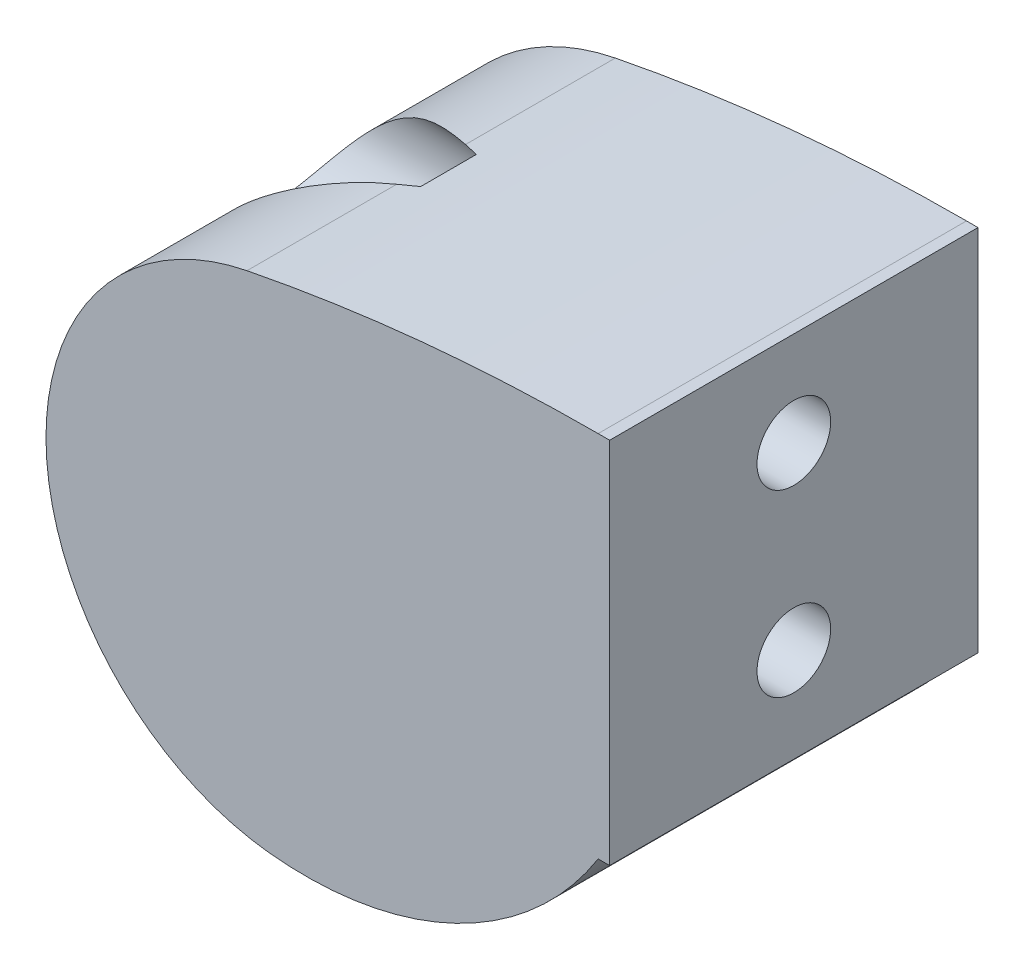
from build123d import *

# Parameters (mm, degrees)
BOSS_EXTRUDE1_DEPTH = 16
CUT_EXTRUDE1_DEPTH  = 27.570660511
SKETCH3_R           = 1.6
CUT_EXTRUDE2_DEPTH  = 33.870624557
SKETCH4_R           = 3
CUT_EXTRUDE3_DEPTH  = 27.570660628


with BuildPart() as part:
    # Sketch1 → Boss-Extrude1 (new body)
    with BuildSketch(Plane.XY):
        with BuildLine():
            Line((12.68857754, 8), (13.18857754, 8))
            Line((13.18857754, 8), (13.18857754, -8))
            Line((13.18857754, -8), (12.68857754, -8))
            ThreePointArc((12.68857754, -8), (-15, 0), (12.68857754, 8))
        make_face()
    extrude(amount=BOSS_EXTRUDE1_DEPTH)

    # Sketch2 → Cut-Extrude1 (cut, through all)
    with BuildSketch(Plane.XY.offset(16)):
        with BuildLine():
            Line((-1.638653084, -14.910225219), (-1.638653084, -32.417274257))
            Line((-1.638653084, -32.417274257), (-50.765498106, -32.417274257))
            Line((-50.765498106, -32.417274257), (-50.765498106, 31.239484016))
            Line((-50.765498106, 31.239484016), (12.68857754, 31.239484016))
            Line((12.68857754, 31.239484016), (12.68857754, 8))
            ThreePointArc((12.68857754, 8), (5.024479817, 7.624084306), (-2.566041885, 6.499946049))
            ThreePointArc((-2.566041885, 6.499946049), (-11.285505358, -4.60291117), (-1.638653084, -14.910225219))
        make_face()
    extrude(amount=-CUT_EXTRUDE1_DEPTH, mode=Mode.SUBTRACT)

    # Sketch3 → Cut-Extrude2 (cut, through all)
    with BuildSketch(Plane(origin=(13.18857754, 0, 0), x_dir=(0, 0, -1), z_dir=(1, 0, 0))):
        with Locations((-8, 3.9)):
            Circle(SKETCH3_R)
        with Locations((-8, -3.9)):
            Circle(SKETCH3_R)
    extrude(amount=-CUT_EXTRUDE2_DEPTH, mode=Mode.SUBTRACT)

    # Sketch4 → Cut-Extrude3 (cut, through all)
    with BuildSketch(Plane(origin=(-1.81142246, 0, 0), x_dir=(0, 0, -1), z_dir=(1, 0, 0))):
        with Locations((-8, 3.9)):
            Circle(SKETCH4_R)
        with Locations((-8, -3.9)):
            Circle(SKETCH4_R)
    extrude(amount=-CUT_EXTRUDE3_DEPTH, mode=Mode.SUBTRACT)


solid = part.part
